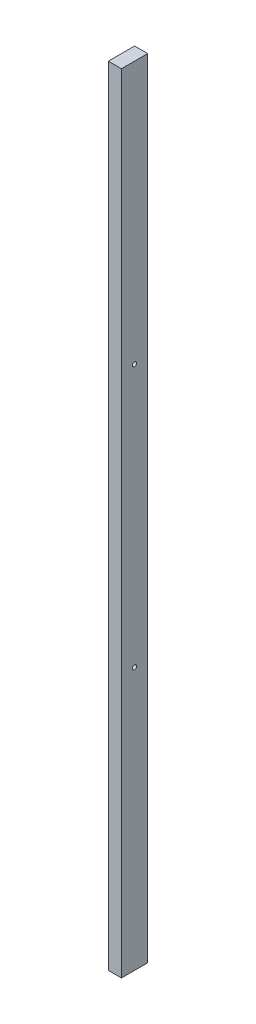
from build123d import *

# Parameters (mm, degrees)
SKETCH_1_W          = 25
SKETCH_1_H          = 50
EXTRUDE_1_DEPTH     = 1500
SKETCH_2_R          = 4
CUT_EXTRUDE_1_DEPTH = 1500


with BuildPart() as part:
    # Эскиз1 → Бобышка-Вытянуть1 (new body)
    with BuildSketch(Plane(origin=(0, 0, 0), x_dir=(1, 0, 0), z_dir=(0, 1, 0))):
        Rectangle(SKETCH_1_W, SKETCH_1_H)
    extrude(amount=EXTRUDE_1_DEPTH)

    # Эскиз2 → Вырез-Вытянуть1 (cut)
    with BuildSketch(Plane.ZY.offset(12.5)):
        with Locations((0, 1000)):
            Circle(SKETCH_2_R)
        with Locations((0, 500)):
            Circle(SKETCH_2_R)
    extrude(amount=-CUT_EXTRUDE_1_DEPTH, mode=Mode.SUBTRACT)


solid = part.part
